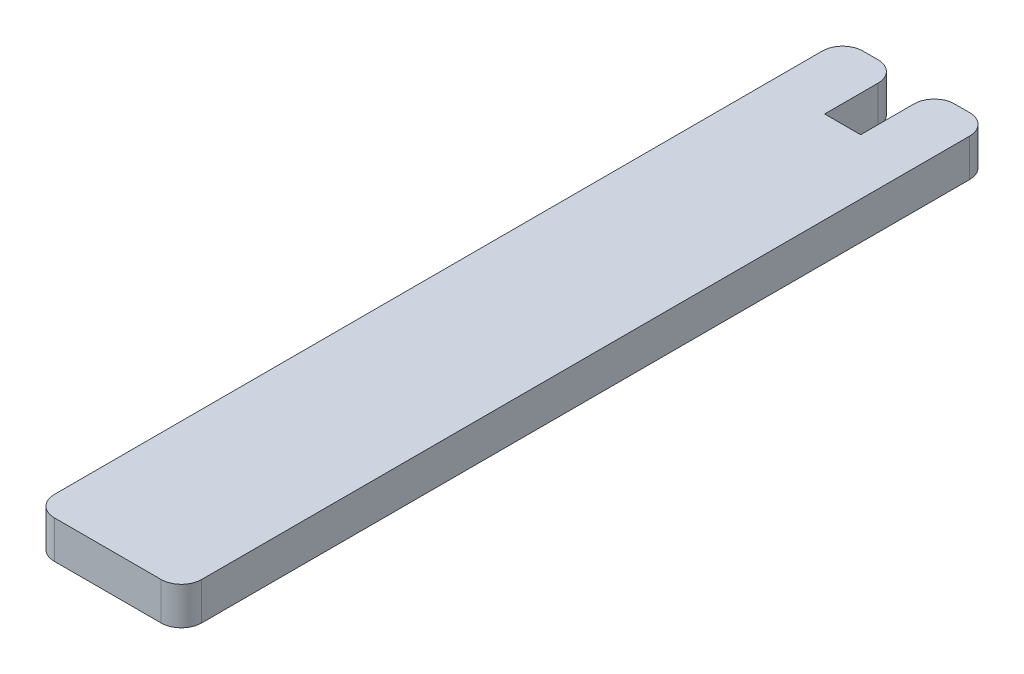
from build123d import *

# Parameters (mm, degrees)
BOSS_EXTRUDE1_DEPTH = 6.5
FILLET1_R           = 3.5


with BuildPart() as part:
    # Sketch1 → Boss-Extrude1 (new body)
    with BuildSketch(Plane(origin=(0, 0, 0), x_dir=(1, 0, 0), z_dir=(0, 1, 0))):
        Polygon((3.1, 69.7), (12.7, 69.7), (12.7, -69.7), (-12.7, -69.7), (-12.7, 69.7), (-3.1, 69.7), (-3.1, 57), (3.1, 57), align=None)
    extrude(amount=BOSS_EXTRUDE1_DEPTH)

    # Fillet1
    fillet1_edges = [part.edges().sort_by_distance(p)[0] for p in [
        (12.7, 3.25, 69.7),
        (-12.7, 3.25, 69.7),
        (-12.7, 3.25, -69.7),
        (-3.1, 3.25, -69.7),
        (3.1, 3.25, -69.7),
        (12.7, 3.25, -69.7),
    ]]
    fillet(fillet1_edges, radius=FILLET1_R)


solid = part.part
